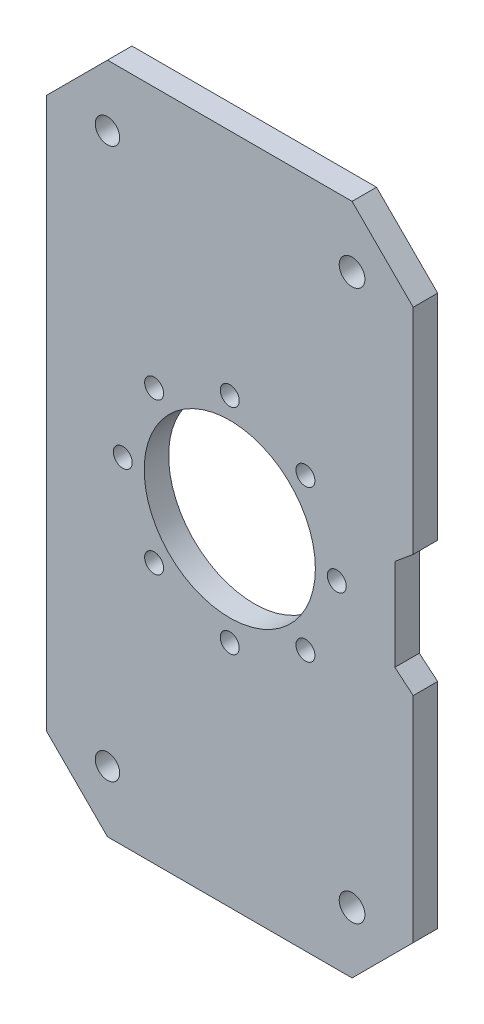
from build123d import *

# Parameters (mm, degrees)
SKETCH_1_W          = 60
SKETCH_1_H          = 110
SKETCH_1_R          = 14
SKETCH_1_R_2        = 2
SKETCH_1_R_3        = 2.1
SKETCH_1_R_4        = 1.55
EXTRUDE_1_DEPTH     = 2
CHAMFER_1_SIZE      = 10
CUT_EXTRUDE_1_DEPTH = 63.777384463


with BuildPart() as part:
    # 草图1 → 凸台-拉伸1 (new, symmetric)
    with BuildSketch(Plane.XY):
        Rectangle(SKETCH_1_W, SKETCH_1_H)
        Circle(SKETCH_1_R, mode=Mode.SUBTRACT)
        with Locations((-20, 45)):
            Circle(SKETCH_1_R_2, mode=Mode.SUBTRACT)
        with Locations((20, 45)):
            Circle(SKETCH_1_R_3, mode=Mode.SUBTRACT)
        with Locations((-20, -45)):
            Circle(SKETCH_1_R_2, mode=Mode.SUBTRACT)
        with Locations((20, -45)):
            Circle(SKETCH_1_R_3, mode=Mode.SUBTRACT)
        with Locations((0, 17.5)):
            Circle(SKETCH_1_R_4, mode=Mode.SUBTRACT)
        with Locations((12.374368671, 12.374368671)):
            Circle(SKETCH_1_R_4, mode=Mode.SUBTRACT)
        with Locations((17.5, 0)):
            Circle(SKETCH_1_R_4, mode=Mode.SUBTRACT)
        with Locations((12.374368671, -12.374368671)):
            Circle(SKETCH_1_R_4, mode=Mode.SUBTRACT)
        with Locations((0, -17.5)):
            Circle(SKETCH_1_R_4, mode=Mode.SUBTRACT)
        with Locations((-12.374368671, -12.374368671)):
            Circle(SKETCH_1_R_4, mode=Mode.SUBTRACT)
        with Locations((-17.5, 0)):
            Circle(SKETCH_1_R_4, mode=Mode.SUBTRACT)
        with Locations((-12.374368671, 12.374368671)):
            Circle(SKETCH_1_R_4, mode=Mode.SUBTRACT)
    extrude(amount=EXTRUDE_1_DEPTH, both=True)

    # 倒角1
    chamfer_1_edges = [part.edges().sort_by_distance(p)[0] for p in [
        (-30, 55, 0),
        (30, 55, 0),
        (30, -55, 0),
        (-30, -55, 0),
    ]]
    chamfer(chamfer_1_edges, length=CHAMFER_1_SIZE)

    # 草图2 → 切除-拉伸1 (cut, through all)
    with BuildSketch(Plane(origin=(0, 0, -2), x_dir=(-1, 0, 0), z_dir=(0, 0, -1))):
        Polygon((-30, -10), (-27, -7.5), (-27, 7.5), (-30, 10), align=None)
    extrude(amount=-CUT_EXTRUDE_1_DEPTH, mode=Mode.SUBTRACT)


solid = part.part
